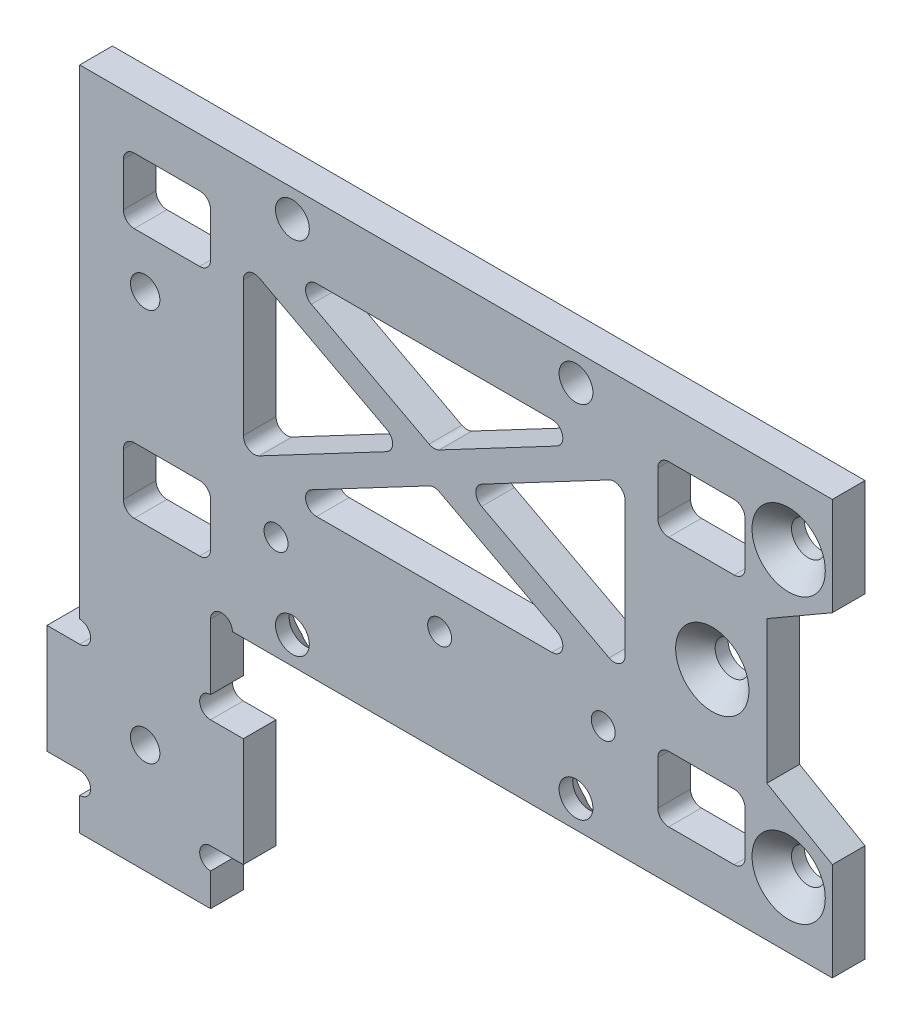
from build123d import *

# Parameters (mm, degrees)
SKETCH_1_R                  = 1.55
SKETCH_1_W                  = 8
SKETCH_1_H                  = 6
EXTRUDE_1_DEPTH             = 3
HOLE_WIZARD_M3_1_AT_2_COUNT = 2
HOLE_WIZARD_M3_1_AT_2_PITCH = 14.76482306
HOLE_WIZARD_M3_1_AT_3_COUNT = 2
HOLE_WIZARD_M3_1_AT_3_PITCH = 26
SKETCH_3_R                  = 1.1
SKETCH_3_R_2                = 1.35
CUT_EXTRUDE_1_DEPTH         = 42.258332492
SKETCH_4_R                  = 1.35
EXTRUDE_2_DEPTH             = 3
SKETCH_5_R                  = 1
CUT_EXTRUDE_2_DEPTH         = 56.724770076
FILLET_1_R                  = 1
HOLE_WIZARD_1_AT_2_COUNT    = 2
HOLE_WIZARD_1_AT_2_PITCH    = 26


with BuildPart() as part:
    # 草图1 → 凸台-拉伸1 (new body)
    with BuildSketch(Plane.XY):
        Polygon((36.5, -19), (-32.5, -19), (-32.5, 19), (36.5, 19), (36.5, 10), (30.5, 6.535898385), (30.5, -6.535898385), (36.5, -10), align=None)
        with Locations((-13, 16.5)):
            Circle(SKETCH_1_R, mode=Mode.SUBTRACT)
        with Locations((-13, -16.5)):
            Circle(SKETCH_1_R, mode=Mode.SUBTRACT)
        with Locations((13, -16.5)):
            Circle(SKETCH_1_R, mode=Mode.SUBTRACT)
        with Locations((13, 16.5)):
            Circle(SKETCH_1_R, mode=Mode.SUBTRACT)
        with Locations((32.5, -13)):
            Circle(SKETCH_1_R, mode=Mode.SUBTRACT)
        with Locations(Location((32.5, 13, 0), (0, 0, 180))):
            Circle(SKETCH_1_R, mode=Mode.SUBTRACT)
        with Locations((25.5, 0)):
            Circle(SKETCH_1_R, mode=Mode.SUBTRACT)
        with Locations((-24.5, -11.5)):
            Rectangle(SKETCH_1_W, SKETCH_1_H, mode=Mode.SUBTRACT)
        with Locations((-24.5, 11.5)):
            Rectangle(SKETCH_1_W, SKETCH_1_H, mode=Mode.SUBTRACT)
        with Locations((24.5, -11.5)):
            Rectangle(SKETCH_1_W, SKETCH_1_H, mode=Mode.SUBTRACT)
        with Locations((24.5, 11.5)):
            Rectangle(SKETCH_1_W, SKETCH_1_H, mode=Mode.SUBTRACT)
    extrude(amount=EXTRUDE_1_DEPTH)

    # 草图2 → M3 六角凹锥坑螺钉的锥形沉头孔1 (revolve, cut)
    with BuildSketch(Plane(origin=(32.5, 13, 3), x_dir=(0, -1, 0), z_dir=(1, 0, 0))):
        Polygon((0, 0), (0, 3), (1.5, 3), (1.5, 1.86), (3.36, 0), align=None)
    hole_wizard_m3_1 = revolve(axis=Axis((32.5, 13, 9.35), (0, 0, -1)), mode=Mode.SUBTRACT)

    # M3 六角凹锥坑螺钉的锥形沉头孔1 at 2: M3 六角凹锥坑螺钉的锥形沉头孔1 ×2
    with Locations(*[Vector(-0.4740998230350173, -0.8804710999221754, 0) * (i * HOLE_WIZARD_M3_1_AT_2_PITCH) for i in range(1, HOLE_WIZARD_M3_1_AT_2_COUNT)]):
        add(hole_wizard_m3_1, mode=Mode.SUBTRACT)

    # M3 六角凹锥坑螺钉的锥形沉头孔1 at 3: M3 六角凹锥坑螺钉的锥形沉头孔1 ×2
    with Locations(*[(0, -i * HOLE_WIZARD_M3_1_AT_3_PITCH, 0) for i in range(1, HOLE_WIZARD_M3_1_AT_3_COUNT)]):
        add(hole_wizard_m3_1, mode=Mode.SUBTRACT)

    # 草图3 → 切除-拉伸1 (cut, through all)
    with BuildSketch(Plane(origin=(0, 0, 0), x_dir=(-1, 0, 0), z_dir=(0, 0, -1))):
        with Locations((14.5, -9.5)):
            Circle(SKETCH_3_R)
        with Locations((-0.5, -9.5)):
            Circle(SKETCH_3_R)
        with Locations((-15.5, -9.5)):
            Circle(SKETCH_3_R)
        with Locations((26.5, 4)):
            Circle(SKETCH_3_R_2)
        Polygon((14.825100782, -6), (0, 1.836124699), (-14.825100782, -6), align=None)
        Polygon((17.5, -4.586124699), (2.674899218, 3.25), (17.5, 11.086124699), align=None)
        Polygon((0, 4.663875301), (-14.825100782, 12.5), (14.825100782, 12.5), align=None)
        Polygon((-2.674899218, 3.25), (-17.5, 11.086124699), (-17.5, -4.586124699), align=None)
    extrude(amount=-CUT_EXTRUDE_1_DEPTH, mode=Mode.SUBTRACT)

    # 草图4 → 凸台-拉伸2 (add)
    with BuildSketch(Plane(origin=(0, 0, 0), x_dir=(-1, 0, 0), z_dir=(0, 0, -1))):
        Polygon((32.5, -19), (20.5, -19), (20.5, -22), (20.5, -27), (17.5, -27), (17.5, -37), (20.5, -37), (20.5, -42), (32.5, -42), (32.5, -37), (35.5, -37), (35.5, -27), (32.5, -27), (32.5, -22), align=None)
        with Locations((26.5, -32)):
            Circle(SKETCH_4_R, mode=Mode.SUBTRACT)
    extrude(amount=-EXTRUDE_2_DEPTH)

    # 草图5 → 切除-拉伸2 (cut, through all)
    with BuildSketch(Plane(origin=(0, 0, 0), x_dir=(-1, 0, 0), z_dir=(0, 0, -1))):
        with Locations((32.5, -38)):
            Circle(SKETCH_5_R)
        with Locations((32.5, -26)):
            Circle(SKETCH_5_R)
        with Locations((19.5, -19)):
            Circle(SKETCH_5_R)
        with Locations((20.5, -38)):
            Circle(SKETCH_5_R)
        with Locations((20.5, -26)):
            Circle(SKETCH_5_R)
    extrude(amount=-CUT_EXTRUDE_2_DEPTH, mode=Mode.SUBTRACT)

    # 圆角1
    fillet_1_edges = [part.edges().sort_by_distance(p)[0] for p in [
        (-14.825100782, -6, 1.5),
        (14.825100782, -6, 1.5),
        (0, 1.836124699, 1.5),
        (2.674899218, 3.25, 1.5),
        (17.5, -4.586124699, 1.5),
        (17.5, 11.086124699, 1.5),
        (-17.5, 11.086124699, 1.5),
        (-17.5, -4.586124699, 1.5),
        (-2.674899218, 3.25, 1.5),
        (-14.825100782, 12.5, 1.5),
        (0, 4.663875301, 1.5),
        (14.825100782, 12.5, 1.5),
        (-28.5, 14.5, 1.5),
        (-28.5, 8.5, 1.5),
        (-20.5, 8.5, 1.5),
        (-20.5, 14.5, 1.5),
        (-20.5, -14.5, 1.5),
        (-20.5, -8.5, 1.5),
        (-28.5, -8.5, 1.5),
        (-28.5, -14.5, 1.5),
        (28.5, -8.5, 1.5),
        (20.5, -8.5, 1.5),
        (20.5, -14.5, 1.5),
        (28.5, -14.5, 1.5),
        (20.5, 14.5, 1.5),
        (20.5, 8.5, 1.5),
        (28.5, 8.5, 1.5),
        (28.5, 14.5, 1.5),
    ]]
    fillet(fillet_1_edges, radius=FILLET_1_R)

    # 草图6 → 打孔尺寸(%根据十字)槽沉头木螺钉的类型1 (revolve, cut)
    with BuildSketch(Plane(origin=(-13, -16.5, 0), x_dir=(0, 1, 0), z_dir=(1, 0, 0))):
        Polygon((0, 0), (0, 3), (1.55, 3), (1.55, 1.75), (3.3, 0), align=None)
    hole_wizard_1 = revolve(axis=Axis((-13, -16.5, -6.35), (0, 0, 1)), mode=Mode.SUBTRACT)

    # 打孔尺寸(%根据十字)槽沉头木螺钉的类型1 at 2: 打孔尺寸(%根据十字)槽沉头木螺钉的类型1 ×2
    with Locations(*[(i * HOLE_WIZARD_1_AT_2_PITCH, 0, 0) for i in range(1, HOLE_WIZARD_1_AT_2_COUNT)]):
        add(hole_wizard_1, mode=Mode.SUBTRACT)


solid = part.part
